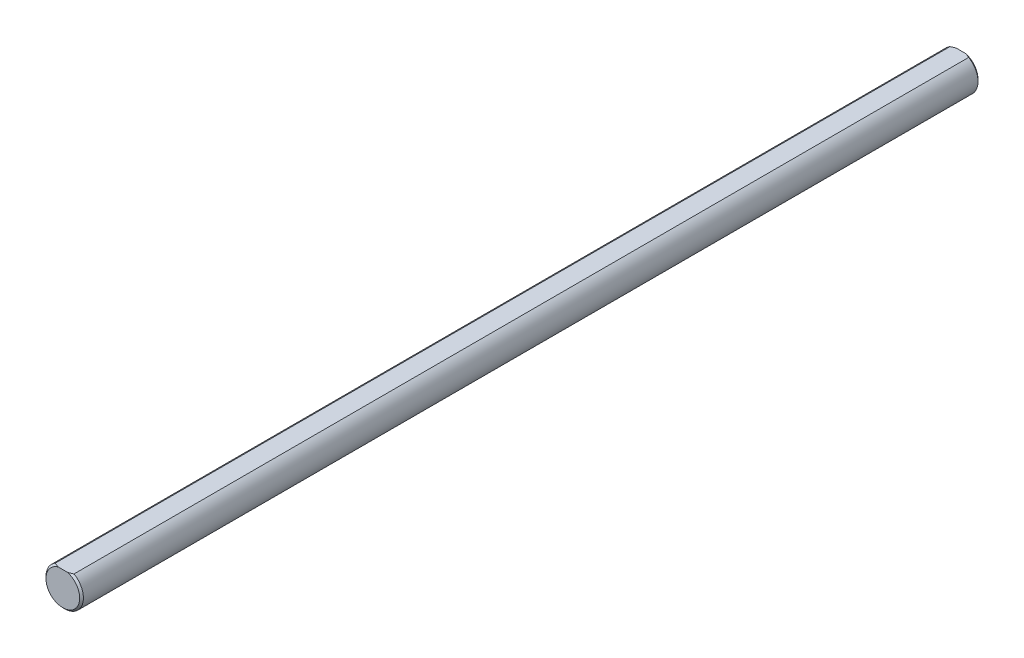
from build123d import *

# Parameters (mm, degrees)
BOSS_EXTRUDE2_DEPTH      = 152.4
BOSS_EXTRUDE2_DEPTH_BACK = 152.4
SKETCH3_R                = 6.35
CUT_EXTRUDE5_DEPTH       = 153.664354058
CUT_EXTRUDE5_DEPTH_BACK  = 153.664354058
CHAMFER1_SIZE            = 0.635


with BuildPart() as part:
    # Sketch3 → Boss-Extrude2 (new, two sides: drawn at the far end of the back side and taken through both)
    with BuildSketch(Plane.XY.offset(-BOSS_EXTRUDE2_DEPTH_BACK)):
        with Locations(Location((0, 0, 0), (0, 0, 180))):
            Circle(SKETCH3_R)
    extrude(amount=BOSS_EXTRUDE2_DEPTH + BOSS_EXTRUDE2_DEPTH_BACK)

    # Sketch10 → Cut-Extrude5 (cut, two sides: drawn at the far end of the back side and taken through both)
    with BuildSketch(Plane.XY.offset(-CUT_EXTRUDE5_DEPTH_BACK)):
        with BuildLine():
            Line((-3.175, 5.499261314), (3.175, 5.499261314))
            ThreePointArc((3.175, 5.499261314), (0, 6.35), (-3.175, 5.499261314))
        make_face()
    extrude(amount=CUT_EXTRUDE5_DEPTH + CUT_EXTRUDE5_DEPTH_BACK, mode=Mode.SUBTRACT)

    # Chamfer1
    chamfer1_edges = [part.edges().sort_by_distance(p)[0] for p in [
        (0, -6.35, -152.4),
        (0, -6.35, 152.4),
    ]]
    chamfer(chamfer1_edges, length=CHAMFER1_SIZE)


solid = part.part
